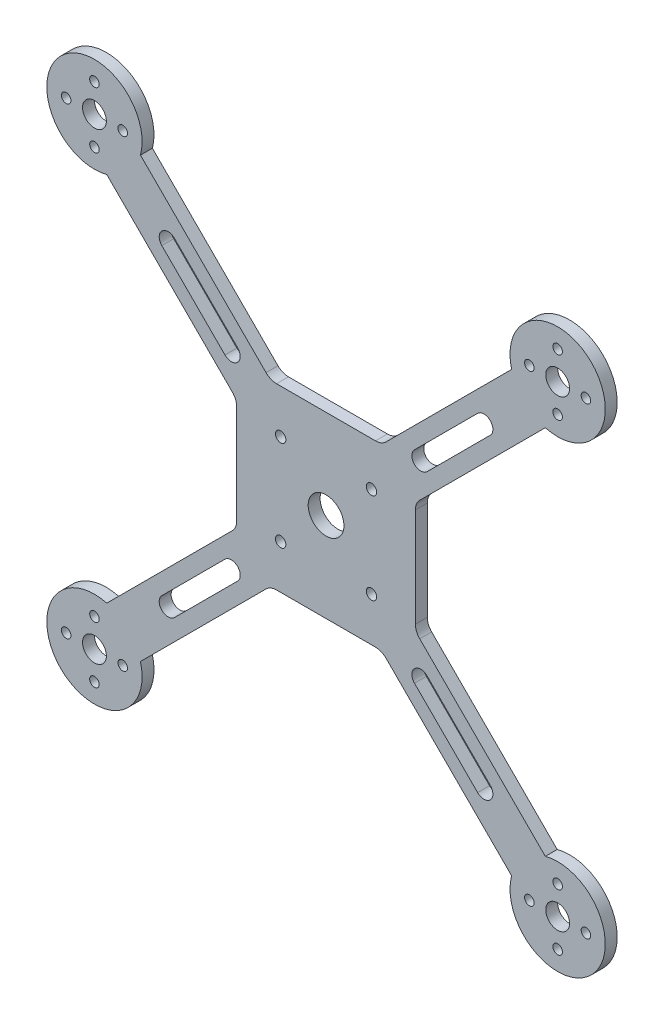
from build123d import *

# Parameters (mm, degrees)
SKETCH_1_W          = 60
SKETCH_1_H          = 60
EXTRUDE_1_DEPTH     = 4
EXTRUDE_2_DEPTH     = 4
SKETCH_3_R          = 16
EXTRUDE_3_DEPTH     = 4
SKETCH_4_R          = 6
CUT_EXTRUDE_1_DEPTH = 133.687643579
SKETCH_5_R          = 1.75
CUT_EXTRUDE_2_DEPTH = 133.687643579
SKETCH_6_R          = 4
CUT_EXTRUDE_3_DEPTH = 133.687643579
SKETCH_7_R          = 1.6
CUT_EXTRUDE_4_DEPTH = 133.687643579
CUT_EXTRUDE_5_DEPTH = 133.687643579
FILLET_1_R          = 5


with BuildPart() as part:
    # 草图1 → 凸台-拉伸1 (new body)
    with BuildSketch(Plane.XY):
        Rectangle(SKETCH_1_W, SKETCH_1_H)
    extrude(amount=EXTRUDE_1_DEPTH)

    # 草图2 → 凸台-拉伸2 (add)
    with BuildSketch(Plane.XY):
        Polygon((18.686292, 30), (72.12484, 83.43854), (83.43854, 72.12484), (30, 18.686292), align=None)
        Polygon((-18.686292, 30), (-72.12484, 83.43854), (-83.43854, 72.12484), (-30, 18.686292), align=None)
        Polygon((-30, -18.686292), (-83.43854, -72.12484), (-72.12484, -83.43854), (-18.686292, -30), align=None)
        Polygon((30, -18.686292), (83.43854, -72.12484), (72.12484, -83.43854), (18.686292, -30), align=None)
    extrude(amount=EXTRUDE_2_DEPTH)

    # 草图3 → 凸台-拉伸3 (add)
    with BuildSketch(Plane.XY):
        with Locations((77.78169, 77.78169)):
            Circle(SKETCH_3_R)
        with Locations((-77.78169, 77.78169)):
            Circle(SKETCH_3_R)
        with Locations((-77.78169, -77.78169)):
            Circle(SKETCH_3_R)
        with Locations((77.78169, -77.78169)):
            Circle(SKETCH_3_R)
    extrude(amount=EXTRUDE_3_DEPTH)

    # 草图4 → 切除-拉伸1 (cut, through all)
    with BuildSketch(Plane.XY):
        Circle(SKETCH_4_R)
    extrude(amount=CUT_EXTRUDE_1_DEPTH, mode=Mode.SUBTRACT)

    # 草图5 → 切除-拉伸2 (cut, through all)
    with BuildSketch(Plane.XY):
        with Locations((15.25, 15.25)):
            Circle(SKETCH_5_R)
        with Locations((-15.25, 15.25)):
            Circle(SKETCH_5_R)
        with Locations((-15.25, -15.25)):
            Circle(SKETCH_5_R)
        with Locations((15.25, -15.25)):
            Circle(SKETCH_5_R)
    extrude(amount=CUT_EXTRUDE_2_DEPTH, mode=Mode.SUBTRACT)

    # 草图6 → 切除-拉伸3 (cut, through all)
    with BuildSketch(Plane.XY):
        with Locations((77.78169, 77.78169)):
            Circle(SKETCH_6_R)
        with Locations((-77.78169, 77.78169)):
            Circle(SKETCH_6_R)
        with Locations((-77.78169, -77.78169)):
            Circle(SKETCH_6_R)
        with Locations((77.78169, -77.78169)):
            Circle(SKETCH_6_R)
    extrude(amount=CUT_EXTRUDE_3_DEPTH, mode=Mode.SUBTRACT)

    # 草图7 → 切除-拉伸4 (cut, through all)
    with BuildSketch(Plane.XY):
        with Locations((87.28169, 77.78169)):
            Circle(SKETCH_7_R)
        with Locations((68.28169, 77.78169)):
            Circle(SKETCH_7_R)
        with Locations((77.78169, 87.28169)):
            Circle(SKETCH_7_R)
        with Locations((77.78169, 68.28169)):
            Circle(SKETCH_7_R)
        with Locations((-87.28169, 77.78169)):
            Circle(SKETCH_7_R)
        with Locations((-68.28169, 77.78169)):
            Circle(SKETCH_7_R)
        with Locations((-77.78169, 87.28169)):
            Circle(SKETCH_7_R)
        with Locations((-77.78169, 68.28169)):
            Circle(SKETCH_7_R)
        with Locations((-87.28169, -77.78169)):
            Circle(SKETCH_7_R)
        with Locations((-68.28169, -77.78169)):
            Circle(SKETCH_7_R)
        with Locations((-77.78169, -87.28169)):
            Circle(SKETCH_7_R)
        with Locations((-77.78169, -68.28169)):
            Circle(SKETCH_7_R)
        with Locations((87.28169, -77.78169)):
            Circle(SKETCH_7_R)
        with Locations((68.28169, -77.78169)):
            Circle(SKETCH_7_R)
        with Locations((77.78169, -87.28169)):
            Circle(SKETCH_7_R)
        with Locations((77.78169, -68.28169)):
            Circle(SKETCH_7_R)
    extrude(amount=CUT_EXTRUDE_4_DEPTH, mode=Mode.SUBTRACT)

    # 草图8 → 切除-拉伸5 (cut, through all)
    with BuildSketch(Plane.XY):
        with BuildLine():
            Line((33.941130344, 29.698489656), (55.154330344, 50.911689656))
            ThreePointArc((55.154330344, 50.911689656), (55.154330344, 55.154330344), (50.911689656, 55.154330344))
            Line((50.911689656, 55.154330344), (29.698489656, 33.941130344))
            ThreePointArc((29.698489656, 33.941130344), (29.698489656, 29.698489656), (33.941130344, 29.698489656))
        make_face()
        with BuildLine():
            Line((-29.698489656, 33.941130344), (-50.911689656, 55.154330344))
            ThreePointArc((-50.911689656, 55.154330344), (-55.154330344, 55.154330344), (-55.154330344, 50.911689656))
            Line((-55.154330344, 50.911689656), (-33.941130344, 29.698489656))
            ThreePointArc((-33.941130344, 29.698489656), (-29.698489656, 29.698489656), (-29.698489656, 33.941130344))
        make_face()
        with BuildLine():
            Line((-33.941130344, -29.698489656), (-55.154330344, -50.911689656))
            ThreePointArc((-55.154330344, -50.911689656), (-55.154330344, -55.154330344), (-50.911689656, -55.154330344))
            Line((-50.911689656, -55.154330344), (-29.698489656, -33.941130344))
            ThreePointArc((-29.698489656, -33.941130344), (-29.698489656, -29.698489656), (-33.941130344, -29.698489656))
        make_face()
        with BuildLine():
            Line((29.698489656, -33.941130344), (50.911689656, -55.154330344))
            ThreePointArc((50.911689656, -55.154330344), (55.154330344, -55.154330344), (55.154330344, -50.911689656))
            Line((55.154330344, -50.911689656), (33.941130344, -29.698489656))
            ThreePointArc((33.941130344, -29.698489656), (29.698489656, -29.698489656), (29.698489656, -33.941130344))
        make_face()
    extrude(amount=CUT_EXTRUDE_5_DEPTH, mode=Mode.SUBTRACT)

    # 圆角1
    fillet_1_edges = [part.edges().sort_by_distance(p)[0] for p in [
        (30, -18.686292, 2),
        (18.686292, -30, 2),
        (-18.686292, -30, 2),
        (-30, -18.686292, 2),
        (-30, 18.686292, 2),
        (-18.686292, 30, 2),
        (18.686292, 30, 2),
        (30, 18.686292, 2),
    ]]
    fillet(fillet_1_edges, radius=FILLET_1_R)


solid = part.part
